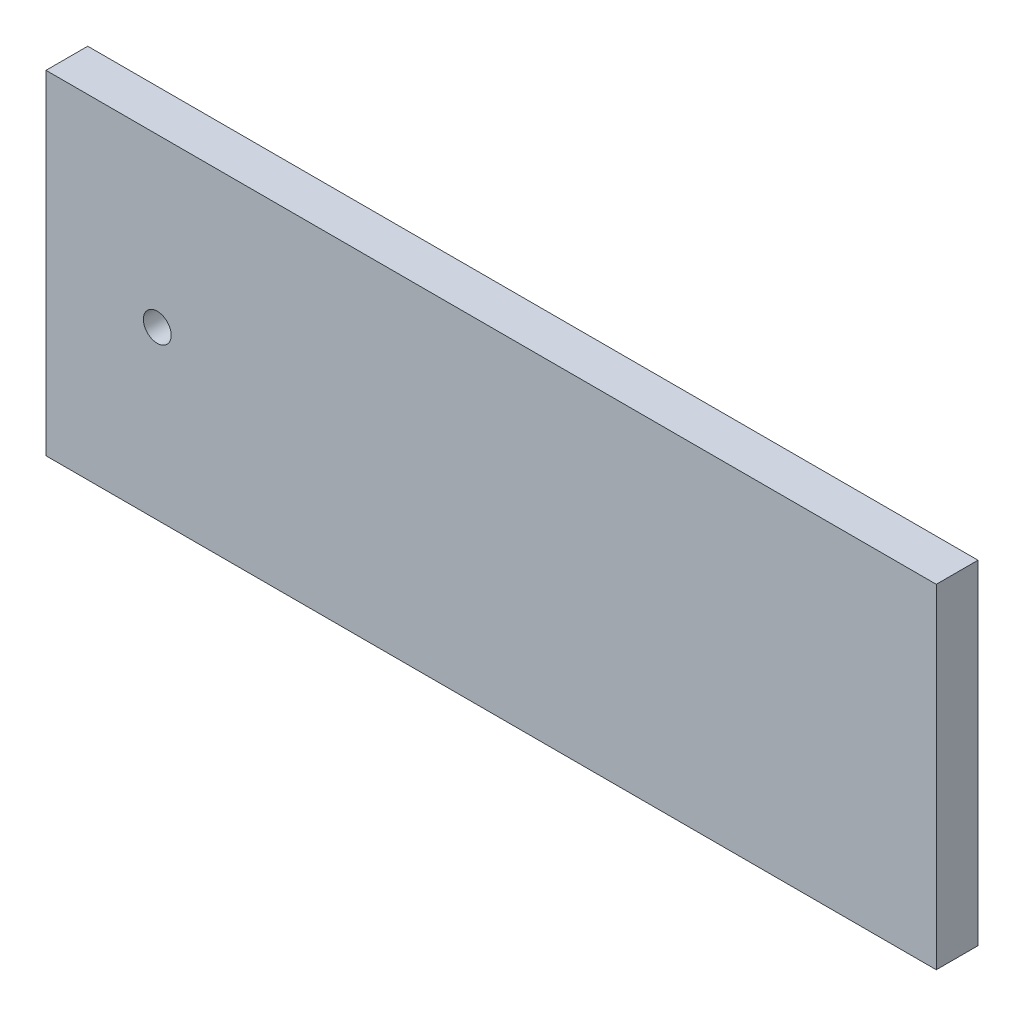
from build123d import *

# Parameters (mm, degrees)
SKETCH2_W       = 203.2
SKETCH2_H       = 76.2
LIN_PLATE_DEPTH = 9.525
SKETCH3_R       = 3.175
LP_SEED_DEPTH   = 218.226622735


with BuildPart() as part:
    # Sketch2 → lin_plate (new body)
    with BuildSketch(Plane.XY):
        with Locations((101.6, 38.1)):
            Rectangle(SKETCH2_W, SKETCH2_H)
    extrude(amount=LIN_PLATE_DEPTH)

    # Sketch3 → lp_seed (cut, through all)
    with BuildSketch(Plane.XY):
        with Locations((25.4, 38.1)):
            Circle(SKETCH3_R)
    extrude(amount=LP_SEED_DEPTH, mode=Mode.SUBTRACT)


solid = part.part
